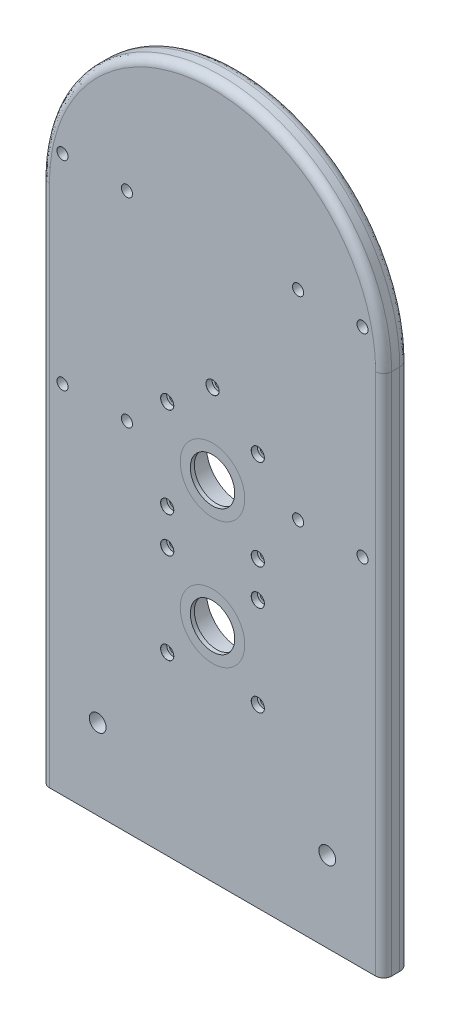
from build123d import *

# Parameters (mm, degrees)
SKETCH1_W                           = 85
SKETCH1_H                           = 20
SKETCH1_R                           = 16.025
BOSS_EXTRUDE1_DEPTH                 = 13
SKETCH2_R                           = 16.025
SKETCH2_R_2                         = 11.025
BOSS_EXTRUDE2_DEPTH                 = 2
BOSS_EXTRUDE2_2_DEPTH               = 2
CUT_EXTRUDE2_DEPTH                  = 0.1
F_3_3_3_3_DIAMETER_HOLE1_AT_2_COUNT = 2
F_3_3_3_3_DIAMETER_HOLE1_AT_2_PITCH = 45
F_3_3_3_3_DIAMETER_HOLE1_AT_3_COUNT = 2
F_3_3_3_3_DIAMETER_HOLE1_AT_3_PITCH = 63.639610307
F_3_3_3_3_DIAMETER_HOLE1_AT_4_COUNT = 2
F_3_3_3_3_DIAMETER_HOLE1_AT_4_PITCH = 45
F_3_3_3_3_DIAMETER_HOLE1_AT_5_COUNT = 2
F_3_3_3_3_DIAMETER_HOLE1_AT_5_PITCH = 48.377862706
F_3_3_3_3_DIAMETER_HOLE1_AT_6_COUNT = 2
F_3_3_3_3_DIAMETER_HOLE1_AT_6_PITCH = 77.225757361
F_3_3_3_3_DIAMETER_HOLE1_AT_7_COUNT = 2
F_3_3_3_3_DIAMETER_HOLE1_AT_7_PITCH = 17.76
F_3_3_3_3_DIAMETER_HOLE1_AT_8_COUNT = 2
F_3_3_3_3_DIAMETER_HOLE1_AT_8_PITCH = 62.76
FILLET3_R                           = 4
FILLET4_R                           = 5
SKETCH26_R                          = 1.7
CUT_EXTRUDE3_DEPTH                  = 356.554496526
SKETCH27_R                          = 2.75
SKETCH27_R_2                        = 4.1656
CUT_EXTRUDE4_DEPTH                  = 356.554496526
CBORE_FOR_M3_SHCS1_AT_2_COUNT       = 2
CBORE_FOR_M3_SHCS1_AT_2_PITCH       = 28.504385627
CBORE_FOR_M3_SHCS1_AT_3_COUNT       = 2
CBORE_FOR_M3_SHCS1_AT_3_PITCH       = 28.504385627
CBORE_FOR_M3_SHCS1_AT_4_COUNT       = 2
CBORE_FOR_M3_SHCS1_AT_4_PITCH       = 66.426651278
CBORE_FOR_M3_SHCS1_AT_5_COUNT       = 2
CBORE_FOR_M3_SHCS1_AT_5_PITCH       = 66.426651278
CBORE_FOR_M3_SHCS1_AT_6_COUNT       = 2
CBORE_FOR_M3_SHCS1_AT_6_PITCH       = 127.264753958
CBORE_FOR_M3_SHCS1_AT_7_COUNT       = 2
CBORE_FOR_M3_SHCS1_AT_7_PITCH       = 83.354169662
CBORE_FOR_M3_SHCS1_AT_8_COUNT       = 2
CBORE_FOR_M3_SHCS1_AT_8_PITCH       = 83.354169662
CBORE_FOR_M3_SHCS1_AT_9_COUNT       = 2
CBORE_FOR_M3_SHCS1_AT_9_PITCH       = 127.264753958


with BuildPart() as part:
    # Sketch1 → Boss-Extrude1 (new body)
    # profile 1 of 3: a face of its own
    with BuildSketch(Plane.XY):
        with Locations((42.5, 10)):
            Rectangle(SKETCH1_W, SKETCH1_H)
    # profile 2 of 3: a face of its own
    with BuildSketch(Plane.XY):
        with Locations((-42.5, 10)):
            Rectangle(SKETCH1_W, SKETCH1_H)
    # profile 3 of 3: a face of its own
    with BuildSketch(Plane.XY):
        with BuildLine():
            Line((0, 20), (85, 20))
            Line((85, 20), (85, 260))
            ThreePointArc((85, 260), (0, 345), (-85, 260))
            Line((-85, 260), (-85, 20))
            Line((-85, 20), (0, 20))
        make_face()
        with BuildLine():
            ThreePointArc((16.025, 110), (11.331386169, 98.668613831), (0, 93.975))
            ThreePointArc((0, 93.975), (-16.025, 110), (0, 126.025))
            ThreePointArc((0, 126.025), (11.331386169, 121.331386169), (16.025, 110))
        make_face(mode=Mode.SUBTRACT)
        with Locations(Location((0, 172.76, 0), (0, 0, 180))):
            Circle(SKETCH1_R, mode=Mode.SUBTRACT)
    extrude(amount=BOSS_EXTRUDE1_DEPTH)

    # Sketch17 → Cut-Extrude2 (cut)
    with BuildSketch(Plane.XY.offset(11)):
        Polygon((-21.82885296, 192.45235063), (-19.732930801, 194.437405702), (-20.404077841, 197.245055071), (-23.17114704, 198.06764937), (-25.267069199, 196.082594298), (-24.595922159, 193.274944929), align=None)
        Polygon((21.82885296, 192.45235063), (24.595922159, 193.274944929), (25.267069199, 196.082594298), (23.17114704, 198.06764937), (20.404077841, 197.245055071), (19.732930801, 194.437405702), align=None)
        Polygon((21.921863094, 147.431733561), (24.660282132, 148.345185533), (25.238419038, 151.173451972), (23.078136906, 153.088266439), (20.339717868, 152.174814467), (19.761580962, 149.346548028), align=None)
        Polygon((-21.921863094, 147.431733561), (-19.761580962, 149.346548028), (-20.339717868, 152.174814467), (-23.078136906, 153.088266439), (-25.238419038, 151.173451972), (-24.660282132, 148.345185533), align=None)
        Polygon((-19.613248654, 132.5), (-21.056624327, 135), (-23.943375673, 135), (-25.386751346, 132.5), (-23.943375673, 130), (-21.056624327, 130), align=None)
        Polygon((19.613248654, 132.5), (21.056624327, 130), (23.943375673, 130), (25.386751346, 132.5), (23.943375673, 135), (21.056624327, 135), align=None)
        Polygon((19.613248654, 87.5), (21.056624327, 85), (23.943375673, 85), (25.386751346, 87.5), (23.943375673, 90), (21.056624327, 90), align=None)
        Polygon((-19.613248654, 87.5), (-21.056624327, 90), (-23.943375673, 90), (-25.386751346, 87.5), (-23.943375673, 85), (-21.056624327, 85), align=None)
    extrude(amount=-CUT_EXTRUDE2_DEPTH, mode=Mode.SUBTRACT)

    # Sketch24 → Ø3.3 (3.3) Diameter Hole1 (revolve, cut)
    with BuildSketch(Plane(origin=(-22.5, 150.26, 13), x_dir=(0, -1, 0), z_dir=(1, 0, 0))):
        Polygon((0, 0), (0, 15.991420021), (1.65, 15), (1.65, 0), align=None)
    f_3_3_3_3_diameter_hole1 = revolve(axis=Axis((-22.5, 150.26, 19.35), (0, 0, -1)), mode=Mode.SUBTRACT)

    # Ø3.3 (3.3) Diameter Hole1 at 2: Ø3.3 (3.3) Diameter Hole1 ×2
    with Locations(*[(0, i * F_3_3_3_3_DIAMETER_HOLE1_AT_2_PITCH, 0) for i in range(1, F_3_3_3_3_DIAMETER_HOLE1_AT_2_COUNT)]):
        add(f_3_3_3_3_diameter_hole1, mode=Mode.SUBTRACT)

    # Ø3.3 (3.3) Diameter Hole1 at 3: Ø3.3 (3.3) Diameter Hole1 ×2
    with Locations(*[Vector(0.7071067811865478, 0.7071067811865472, 0) * (i * F_3_3_3_3_DIAMETER_HOLE1_AT_3_PITCH) for i in range(1, F_3_3_3_3_DIAMETER_HOLE1_AT_3_COUNT)]):
        add(f_3_3_3_3_diameter_hole1, mode=Mode.SUBTRACT)

    # Ø3.3 (3.3) Diameter Hole1 at 4: Ø3.3 (3.3) Diameter Hole1 ×2
    with Locations(*[(i * F_3_3_3_3_DIAMETER_HOLE1_AT_4_PITCH, 0, 0) for i in range(1, F_3_3_3_3_DIAMETER_HOLE1_AT_4_COUNT)]):
        add(f_3_3_3_3_diameter_hole1, mode=Mode.SUBTRACT)

    # Ø3.3 (3.3) Diameter Hole1 at 5: Ø3.3 (3.3) Diameter Hole1 ×2
    with Locations(*[Vector(0.9301775126668539, -0.3671100583325181, 0) * (i * F_3_3_3_3_DIAMETER_HOLE1_AT_5_PITCH) for i in range(1, F_3_3_3_3_DIAMETER_HOLE1_AT_5_COUNT)]):
        add(f_3_3_3_3_diameter_hole1, mode=Mode.SUBTRACT)

    # Ø3.3 (3.3) Diameter Hole1 at 6: Ø3.3 (3.3) Diameter Hole1 ×2
    with Locations(*[Vector(0.5827071373294203, -0.8126822208620982, 0) * (i * F_3_3_3_3_DIAMETER_HOLE1_AT_6_PITCH) for i in range(1, F_3_3_3_3_DIAMETER_HOLE1_AT_6_COUNT)]):
        add(f_3_3_3_3_diameter_hole1, mode=Mode.SUBTRACT)

    # Ø3.3 (3.3) Diameter Hole1 at 7: Ø3.3 (3.3) Diameter Hole1 ×2
    with Locations(*[(0, -i * F_3_3_3_3_DIAMETER_HOLE1_AT_7_PITCH, 0) for i in range(1, F_3_3_3_3_DIAMETER_HOLE1_AT_7_COUNT)]):
        add(f_3_3_3_3_diameter_hole1, mode=Mode.SUBTRACT)

    # Ø3.3 (3.3) Diameter Hole1 at 8: Ø3.3 (3.3) Diameter Hole1 ×2
    with Locations(*[(0, -i * F_3_3_3_3_DIAMETER_HOLE1_AT_8_PITCH, 0) for i in range(1, F_3_3_3_3_DIAMETER_HOLE1_AT_8_COUNT)]):
        add(f_3_3_3_3_diameter_hole1, mode=Mode.SUBTRACT)

    # Fillet3
    fillet3_edges = [part.edges().sort_by_distance(p)[0] for p in [
        (-85, 130, 13),
        (85, 130, 13),
        (0, 345, 13),
    ]]
    fillet(fillet3_edges, radius=FILLET3_R)

    # Fillet4
    fillet4_edges = [part.edges().sort_by_distance(p)[0] for p in [
        (-85, 130, 0),
        (0, 345, 0),
        (85, 130, 0),
    ]]
    fillet(fillet4_edges, radius=FILLET4_R)

    # Sketch26 → Cut-Extrude3 (cut, through all)
    with BuildSketch(Plane(origin=(0, 0, 0), x_dir=(-1, 0, 0), z_dir=(0, 0, -1))):
        with Locations((0, 212.76)):
            Circle(SKETCH26_R)
    extrude(amount=-CUT_EXTRUDE3_DEPTH, mode=Mode.SUBTRACT)

    # Sketch27 → Cut-Extrude4 (cut, through all)
    with BuildSketch(Plane.XY.offset(13)):
        with Locations((-74.5, 276)):
            Circle(SKETCH27_R)
        with Locations((56.9914, 39.9898)):
            Circle(SKETCH27_R_2)
        with Locations((-57.0168, 39.9898)):
            Circle(SKETCH27_R_2)
        with Locations((42.5, 276)):
            Circle(SKETCH27_R)
        with Locations((42.5, 177)):
            Circle(SKETCH27_R)
        with Locations((-74.5, 177)):
            Circle(SKETCH27_R)
        with Locations((74.5, 177)):
            Circle(SKETCH27_R)
        with Locations((74.5, 276)):
            Circle(SKETCH27_R)
        with BuildLine():
            ThreePointArc((-42.5, 273.25), (-39.75, 276), (-42.5, 278.75))
            ThreePointArc((-42.5, 278.75), (-45.25, 276), (-42.5, 273.25))
        make_face()
        with BuildLine():
            ThreePointArc((-42.5, 174.25), (-39.75, 177), (-42.5, 179.75))
            ThreePointArc((-42.5, 179.75), (-45.25, 177), (-42.5, 174.25))
        make_face()
    extrude(amount=-CUT_EXTRUDE4_DEPTH, mode=Mode.SUBTRACT)

    # Sketch30 → CBORE for M3 SHCS1 (revolve, cut)
    with BuildSketch(Plane(origin=(0, 212.76, 13), x_dir=(0, -1, 0), z_dir=(1, 0, 0))):
        Polygon((0, 0), (0, 13.025), (1.8, 13.025), (1.8, 3), (3.25, 3), (3.25, 0.025), (3.275, 0), align=None)
    cbore_for_m3_shcs1 = revolve(axis=Axis((0, 212.76, 19.35), (0, 0, -1)), mode=Mode.SUBTRACT)

    # CBORE for M3 SHCS1 at 2: CBORE for M3 SHCS1 ×2
    with Locations(*[Vector(-0.7893522173763236, -0.6139406135149239, 0) * (i * CBORE_FOR_M3_SHCS1_AT_2_PITCH) for i in range(1, CBORE_FOR_M3_SHCS1_AT_2_COUNT)]):
        add(cbore_for_m3_shcs1, mode=Mode.SUBTRACT)

    # CBORE for M3 SHCS1 at 3: CBORE for M3 SHCS1 ×2
    with Locations(*[Vector(0.7893522173763435, -0.6139406135148984, 0) * (i * CBORE_FOR_M3_SHCS1_AT_3_PITCH) for i in range(1, CBORE_FOR_M3_SHCS1_AT_3_COUNT)]):
        add(cbore_for_m3_shcs1, mode=Mode.SUBTRACT)

    # CBORE for M3 SHCS1 at 4: CBORE for M3 SHCS1 ×2
    with Locations(*[Vector(0.3387194682727538, -0.9408874118687225, 0) * (i * CBORE_FOR_M3_SHCS1_AT_4_PITCH) for i in range(1, CBORE_FOR_M3_SHCS1_AT_4_COUNT)]):
        add(cbore_for_m3_shcs1, mode=Mode.SUBTRACT)

    # CBORE for M3 SHCS1 at 5: CBORE for M3 SHCS1 ×2
    with Locations(*[Vector(-0.3387194682727339, -0.9408874118687296, 0) * (i * CBORE_FOR_M3_SHCS1_AT_5_PITCH) for i in range(1, CBORE_FOR_M3_SHCS1_AT_5_COUNT)]):
        add(cbore_for_m3_shcs1, mode=Mode.SUBTRACT)

    # CBORE for M3 SHCS1 at 6: CBORE for M3 SHCS1 ×2
    with Locations(*[Vector(-0.17679679015776878, -0.9842473748961234, 0) * (i * CBORE_FOR_M3_SHCS1_AT_6_PITCH) for i in range(1, CBORE_FOR_M3_SHCS1_AT_6_COUNT)]):
        add(cbore_for_m3_shcs1, mode=Mode.SUBTRACT)

    # CBORE for M3 SHCS1 at 7: CBORE for M3 SHCS1 ×2
    with Locations(*[Vector(-0.2699325071715521, -0.9628792455817501, 0) * (i * CBORE_FOR_M3_SHCS1_AT_7_PITCH) for i in range(1, CBORE_FOR_M3_SHCS1_AT_7_COUNT)]):
        add(cbore_for_m3_shcs1, mode=Mode.SUBTRACT)

    # CBORE for M3 SHCS1 at 8: CBORE for M3 SHCS1 ×2
    with Locations(*[Vector(0.2699325071715689, -0.9628792455817453, 0) * (i * CBORE_FOR_M3_SHCS1_AT_8_PITCH) for i in range(1, CBORE_FOR_M3_SHCS1_AT_8_COUNT)]):
        add(cbore_for_m3_shcs1, mode=Mode.SUBTRACT)

    # CBORE for M3 SHCS1 at 9: CBORE for M3 SHCS1 ×2
    with Locations(*[Vector(0.1767967901577801, -0.9842473748961212, 0) * (i * CBORE_FOR_M3_SHCS1_AT_9_PITCH) for i in range(1, CBORE_FOR_M3_SHCS1_AT_9_COUNT)]):
        add(cbore_for_m3_shcs1, mode=Mode.SUBTRACT)


with BuildPart() as body_2:
    # Sketch2 → Boss-Extrude2 (new body)
    with BuildSketch(Plane(origin=(0, 0, 13), x_dir=(-1, 0, 0), z_dir=(0, 0, -1))):
        with Locations((0, 172.76)):
            Circle(SKETCH2_R)
        with Locations((0, 172.76)):
            Circle(SKETCH2_R_2, mode=Mode.SUBTRACT)
    extrude(amount=BOSS_EXTRUDE2_DEPTH)


with BuildPart() as body_3:
    # Sketch2 → Boss-Extrude2 2 (new body)
    with BuildSketch(Plane(origin=(0, 0, 13), x_dir=(-1, 0, 0), z_dir=(0, 0, -1))):
        with Locations((0, 110)):
            Circle(SKETCH2_R)
        with Locations((0, 110)):
            Circle(SKETCH2_R_2, mode=Mode.SUBTRACT)
    extrude(amount=BOSS_EXTRUDE2_2_DEPTH)


solid = Compound([part.part, body_2.part, body_3.part])
